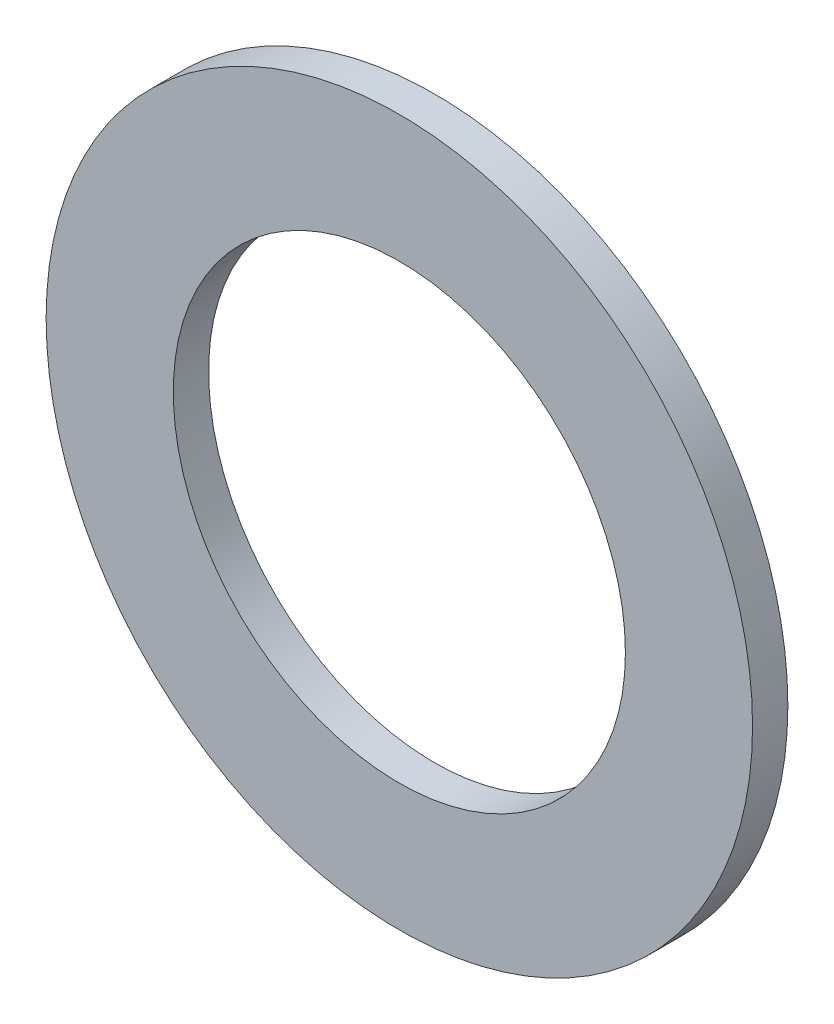
from build123d import *

# Parameters (mm, degrees)
SKETCH1_R           = 19.84375
SKETCH1_R_2         = 12.7
BOSS_EXTRUDE1_DEPTH = 1.98374


with BuildPart() as part:
    # Sketch1 → Boss-Extrude1 (new body)
    with BuildSketch(Plane.XY):
        Circle(SKETCH1_R)
        Circle(SKETCH1_R_2, mode=Mode.SUBTRACT)
    extrude(amount=BOSS_EXTRUDE1_DEPTH)


solid = part.part
